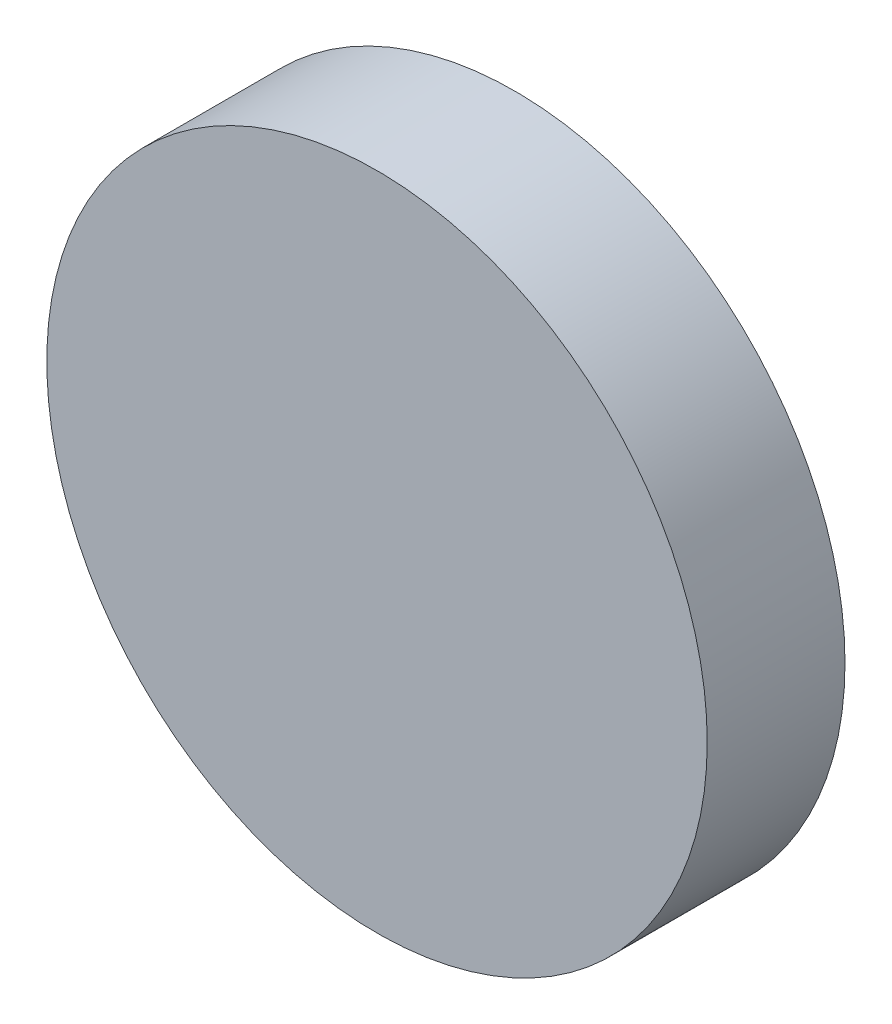
from build123d import *

# Parameters (mm, degrees)
ESQUISSE1_R        = 95.870432567
BOSS_EXTRU_1_DEPTH = 40


with BuildPart() as part:
    # Esquisse1 → Boss.-Extru.1 (new body)
    with BuildSketch(Plane.XY):
        with Locations((-63.263942929, 46.136307054)):
            Circle(ESQUISSE1_R)
    extrude(amount=BOSS_EXTRU_1_DEPTH)


solid = part.part
